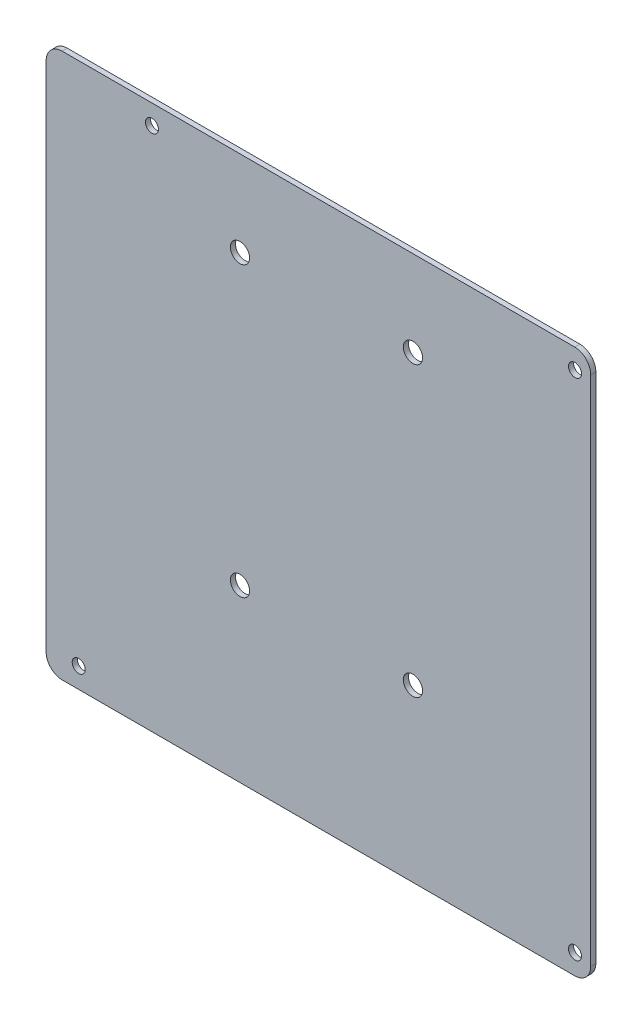
from build123d import *

# Parameters (mm, degrees)
ESQUISSE1_R        = 2.032
ESQUISSE1_R_2      = 3
BOSS_EXTRU_1_DEPTH = 1.6


with BuildPart() as part:
    # Esquisse1 → Boss.-Extru.1 (new body)
    with BuildSketch(Plane.XY):
        with BuildLine():
            Line((-15.079731492, -111.047181826), (-15.079731492, 48.952818174))
            ThreePointArc((-15.079731492, 48.952818174), (-13.615265398, 52.48835208), (-10.079731492, 53.952818174))
            Line((-10.079731492, 53.952818174), (149.920268508, 53.952818174))
            ThreePointArc((149.920268508, 53.952818174), (153.455802414, 52.48835208), (154.920268508, 48.952818174))
            Line((154.920268508, 48.952818174), (154.920268508, -111.047181826))
            ThreePointArc((154.920268508, -111.047181826), (153.455802414, -114.582715732), (149.920268508, -116.047181826))
            Line((149.920268508, -116.047181826), (-10.079731492, -116.047181826))
            ThreePointArc((-10.079731492, -116.047181826), (-13.615265398, -114.582715732), (-15.079731492, -111.047181826))
        make_face()
        with Locations((-4.919731492, -109.697181826)):
            Circle(ESQUISSE1_R, mode=Mode.SUBTRACT)
        with Locations((17.940268508, 47.782818174)):
            Circle(ESQUISSE1_R, mode=Mode.SUBTRACT)
        with Locations((150.020268508, 47.782818174)):
            Circle(ESQUISSE1_R, mode=Mode.SUBTRACT)
        with Locations((150.020268508, -109.697181826)):
            Circle(ESQUISSE1_R, mode=Mode.SUBTRACT)
        with Locations((45.420268508, -62.747181826)):
            Circle(ESQUISSE1_R_2, mode=Mode.SUBTRACT)
        with Locations((45.420268508, 27.252818174)):
            Circle(ESQUISSE1_R_2, mode=Mode.SUBTRACT)
        with Locations((99.420268508, 27.252818174)):
            Circle(ESQUISSE1_R_2, mode=Mode.SUBTRACT)
        with Locations((99.420268508, -62.747181826)):
            Circle(ESQUISSE1_R_2, mode=Mode.SUBTRACT)
    extrude(amount=BOSS_EXTRU_1_DEPTH)


solid = part.part
